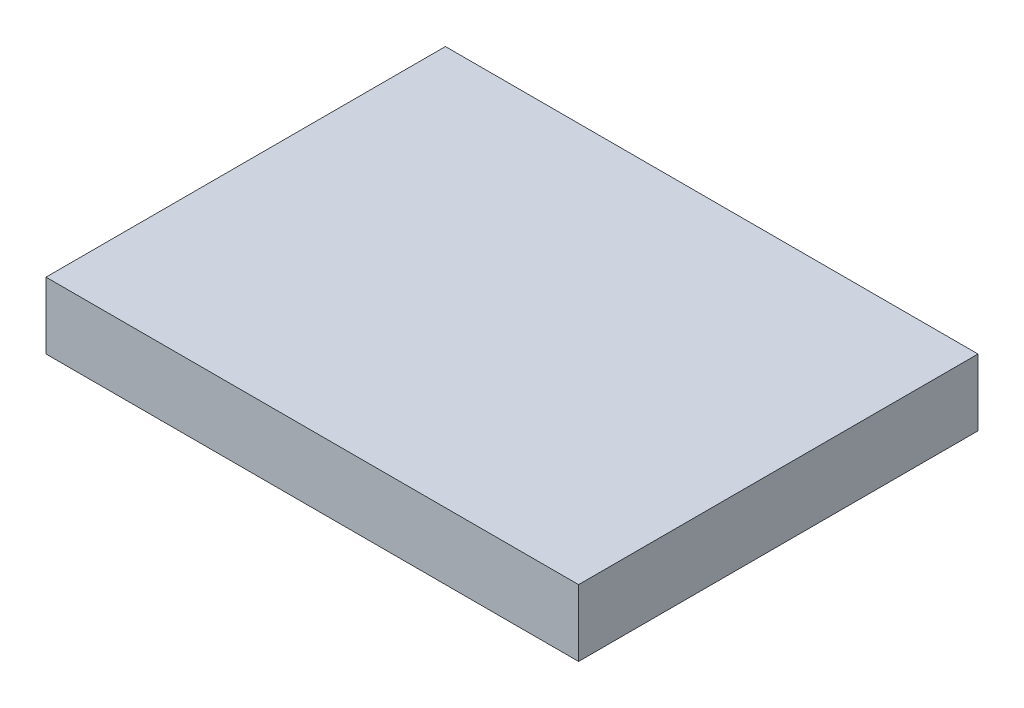
from build123d import *

# Parameters (mm, degrees)
ESBO_O1_W                = 24
ESBO_O1_H                = 18
RESSALTO_EXTRUS_O1_DEPTH = 3


with BuildPart() as part:
    # Esboço1 → Ressalto-extrusão1 (new body)
    with BuildSketch(Plane(origin=(0, 0, 0), x_dir=(1, 0, 0), z_dir=(0, 1, 0))):
        with Locations((-47.28163089, 3.200259965)):
            Rectangle(ESBO_O1_W, ESBO_O1_H)
    extrude(amount=RESSALTO_EXTRUS_O1_DEPTH)


solid = part.part
